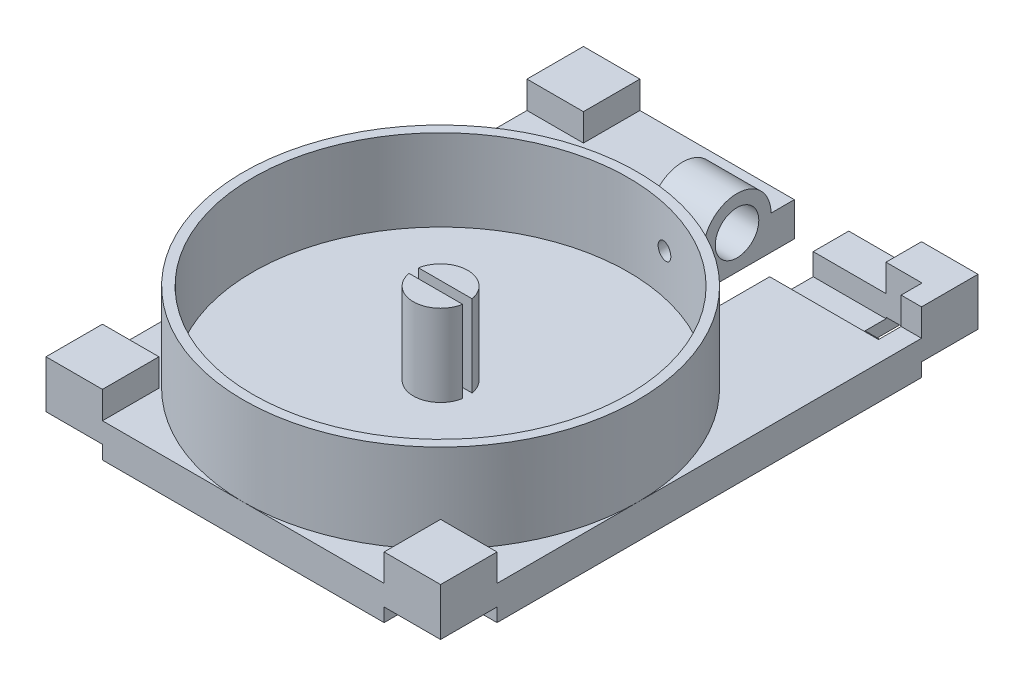
from build123d import *

# Parameters (mm, degrees)
SKETCH1_W               = 29
SKETCH1_H               = 50
BOSS_EXTRUDE1_DEPTH     = 2.5
BOSS_EXTRUDE3_DEPTH     = 6
BOSS_EXTRUDE4_DEPTH     = 6
CUT_EXTRUDE1_DEPTH      = 6
CUT_EXTRUDE2_DEPTH      = 6
CUT_EXTRUDE3_DEPTH      = 10
CUT_EXTRUDE3_DEPTH_BACK = 4
SKETCH6_R               = 1.6
SKETCH7_R               = 2.5
SKETCH7_R_2             = 1.6
BOSS_EXTRUDE6_DEPTH     = 4
SKETCH8_W               = 3.2
SKETCH8_H               = 1.6
CUT_EXTRUDE4_DEPTH      = 8
CUT_EXTRUDE5_DEPTH      = 5
SKETCH10_R              = 12.5
SKETCH10_W              = 4.15
SKETCH10_H              = 4.15
CUT_EXTRUDE7_DEPTH      = 1
SKETCH11_W              = 4.15
SKETCH11_H              = 4.15
BOSS_EXTRUDE7_DEPTH     = 2
SKETCH13_R              = 1.1
CUT_EXTRUDE8_DEPTH      = 1.1
SKETCH14_R              = 12.5
CUT_EXTRUDE9_DEPTH      = 1
SKETCH15_R              = 13.8
BOSS_EXTRUDE8_DEPTH     = 0.5
SKETCH16_R              = 14.5
SKETCH16_R_2            = 13.8
BOSS_EXTRUDE9_DEPTH     = 0.5


with BuildPart() as part:
    # Sketch1 → Boss-Extrude1 (new body)
    with BuildSketch(Plane(origin=(0, 0, 0), x_dir=(1, 0, 0), z_dir=(0, 1, 0))):
        with Locations((-98.70287726, -30.536357795)):
            Rectangle(SKETCH1_W, SKETCH1_H)
    extrude(amount=BOSS_EXTRUDE1_DEPTH)

    # Sketch2 → Boss-Extrude3 (add)
    with BuildSketch(Plane(origin=(0, 2.5, 0), x_dir=(1, 0, 0), z_dir=(0, 1, 0))):
        with BuildLine():
            ThreePointArc((-84.20287726, -41.036357795), (-108.955925587, -30.783309468), (-98.70287726, -55.536357795))
            ThreePointArc((-98.70287726, -55.536357795), (-88.449828932, -51.289406123), (-84.20287726, -41.036357795))
        make_face()
        with BuildLine():
            ThreePointArc((-84.90287726, -41.036357795), (-88.944803679, -50.794431376), (-98.70287726, -54.836357795))
            ThreePointArc((-98.70287726, -54.836357795), (-108.46095084, -31.278284215), (-84.90287726, -41.036357795))
        make_face(mode=Mode.SUBTRACT)
    extrude(amount=BOSS_EXTRUDE3_DEPTH)

    # Sketch3 → Boss-Extrude4 (add)
    with BuildSketch(Plane(origin=(0, 2.5, 0), x_dir=(1, 0, 0), z_dir=(0, 1, 0))):
        with BuildLine():
            Line((-100.672014126, -40.686357795), (-96.733740393, -40.686357795))
            ThreePointArc((-96.733740393, -40.686357795), (-98.70287726, -39.036357795), (-100.672014126, -40.686357795))
        make_face()
        with BuildLine():
            Line((-96.733740393, -41.386357795), (-100.672014126, -41.386357795))
            ThreePointArc((-100.672014126, -41.386357795), (-98.70287726, -43.036357795), (-96.733740393, -41.386357795))
        make_face()
    extrude(amount=BOSS_EXTRUDE4_DEPTH)

    # Sketch4 → Cut-Extrude1 (cut)
    with BuildSketch(Plane(origin=(0, 2.5, 0), x_dir=(1, 0, 0), z_dir=(0, 1, 0))):
        Polygon((-97.70287726, -14.248512358), (-97.70287726, -20.248512358), (-97.70287726, -26.248512358), (-93.70287726, -26.248512358), (-93.70287726, -14.248512358), align=None)
    extrude(amount=-CUT_EXTRUDE1_DEPTH, mode=Mode.SUBTRACT)

    # Sketch5 → Cut-Extrude2 (cut)
    with BuildSketch(Plane(origin=(0, 0, 26.248512358), x_dir=(-1, 0, 0), z_dir=(0, 0, -1))):
        with BuildLine():
            ThreePointArc((95.70287726, 5.4), (96.127141328, 5.575735931), (96.30287726, 6))
            ThreePointArc((96.30287726, 6), (95.278613191, 6.424264069), (95.70287726, 5.4))
        make_face()
    extrude(amount=-CUT_EXTRUDE2_DEPTH, mode=Mode.SUBTRACT)

    # Sketch6 → Cut-Extrude3 (cut, two sides: drawn at the far end of the back side and taken through both)
    with BuildSketch(Plane(origin=(-97.70287726, 0, 0), x_dir=(0, 0, -1), z_dir=(1, 0, 0)).offset(-CUT_EXTRUDE3_DEPTH_BACK)):
        with Locations((-20.248512358, 2.5)):
            Circle(SKETCH6_R)
    extrude(amount=CUT_EXTRUDE3_DEPTH + CUT_EXTRUDE3_DEPTH_BACK, mode=Mode.SUBTRACT)

    # Sketch7 → Boss-Extrude6 (add)
    with BuildSketch(Plane(origin=(-97.70287726, 0, 0), x_dir=(0, 0, -1), z_dir=(1, 0, 0))):
        with Locations((-20.248512358, 2.5)):
            Circle(SKETCH7_R)
        with Locations((-20.248512358, 2.5)):
            Circle(SKETCH7_R_2, mode=Mode.SUBTRACT)
    extrude(amount=-BOSS_EXTRUDE6_DEPTH)

    # Sketch8 → Cut-Extrude4 (cut)
    with BuildSketch(Plane.ZY.offset(93.70287726)):
        with Locations((20.248512358, 1.7)):
            Rectangle(SKETCH8_W, SKETCH8_H)
    extrude(amount=-CUT_EXTRUDE4_DEPTH, mode=Mode.SUBTRACT)

    # Sketch9 → Cut-Extrude5 (cut)
    with BuildSketch(Plane(origin=(0, 2.5, 0), x_dir=(1, 0, 0), z_dir=(0, 1, 0))):
        Polygon((-113.20287726, -5.536357795), (-113.20287726, -16.036357795), (-97.70287726, -16.036357795), (-97.70287726, -14.248512358), (-93.70287726, -14.248512358), (-93.70287726, -16.036357795), (-84.20287726, -16.036357795), (-84.20287726, -5.536357795), align=None)
    extrude(amount=-CUT_EXTRUDE5_DEPTH, mode=Mode.SUBTRACT)

    # Sketch10 → Cut-Extrude7 (cut)
    with BuildSketch(Plane.XZ):
        with Locations((-98.70287726, 41.036357795)):
            Circle(SKETCH10_R)
        with Locations((-86.27787726, 18.111357795)):
            Rectangle(SKETCH10_W, SKETCH10_H)
        with Locations((-86.27787726, 53.461357795)):
            Rectangle(SKETCH10_W, SKETCH10_H)
        with Locations((-111.12787726, 18.111357795)):
            Rectangle(SKETCH10_W, SKETCH10_H)
        with Locations((-111.12787726, 53.461357795)):
            Rectangle(SKETCH10_W, SKETCH10_H)
    extrude(amount=-CUT_EXTRUDE7_DEPTH, mode=Mode.SUBTRACT)

    # Sketch11 → Boss-Extrude7 (add)
    with BuildSketch(Plane(origin=(0, 2.5, 0), x_dir=(1, 0, 0), z_dir=(0, 1, 0))):
        Polygon((-88.35287726, -16.036357795), (-88.35287726, -18.648512358), (-85.70287726, -18.648512358), (-85.70287726, -20.186357795), (-84.20287726, -20.186357795), (-84.20287726, -16.036357795), align=None)
        with Locations((-111.12787726, -53.461357795)):
            Rectangle(SKETCH11_W, SKETCH11_H)
        with Locations((-86.27787726, -53.461357795)):
            Rectangle(SKETCH11_W, SKETCH11_H)
        with Locations((-111.12787726, -18.111357795)):
            Rectangle(SKETCH11_W, SKETCH11_H)
    extrude(amount=BOSS_EXTRUDE7_DEPTH)

    # Sketch13 → Cut-Extrude8 (cut)
    with BuildSketch(Plane.XZ.offset(-1)):
        with Locations((-111.12787726, 53.461357795)):
            Circle(SKETCH13_R)
        with Locations((-86.27787726, 53.461357795)):
            Circle(SKETCH13_R)
        with Locations((-111.12787726, 18.111357795)):
            Circle(SKETCH13_R)
        with Locations((-86.27787726, 18.111357795)):
            Circle(SKETCH13_R)
    extrude(amount=-CUT_EXTRUDE8_DEPTH, mode=Mode.SUBTRACT)

    # Sketch14 → Cut-Extrude9 (cut)
    with BuildSketch(Plane.XZ.offset(-1)):
        with Locations((-98.70287726, 41.036357795)):
            Circle(SKETCH14_R)
    extrude(amount=-CUT_EXTRUDE9_DEPTH, mode=Mode.SUBTRACT)

    # Sketch15 → Boss-Extrude8 (add)
    with BuildSketch(Plane(origin=(0, 2.5, 0), x_dir=(1, 0, 0), z_dir=(0, 1, 0))):
        with Locations((-98.70287726, -41.036357795)):
            Circle(SKETCH15_R)
    extrude(amount=BOSS_EXTRUDE8_DEPTH)

    # Sketch16 → Boss-Extrude9 (add)
    # profile 1 of 3: a face of its own
    with BuildSketch(Plane(origin=(0, 8.5, 0), x_dir=(1, 0, 0), z_dir=(0, 1, 0))):
        with Locations((-98.70287726, -41.036357795)):
            Circle(SKETCH16_R)
        with Locations((-98.70287726, -41.036357795)):
            Circle(SKETCH16_R_2, mode=Mode.SUBTRACT)
    # profile 2 of 3: a face of its own
    with BuildSketch(Plane(origin=(0, 8.5, 0), x_dir=(1, 0, 0), z_dir=(0, 1, 0))):
        with BuildLine():
            ThreePointArc((-96.733740393, -40.686357795), (-98.70287726, -39.036357795), (-100.672014126, -40.686357795))
            Line((-100.672014126, -40.686357795), (-96.733740393, -40.686357795))
        make_face()
    # profile 3 of 3: a face of its own
    with BuildSketch(Plane(origin=(0, 8.5, 0), x_dir=(1, 0, 0), z_dir=(0, 1, 0))):
        with BuildLine():
            ThreePointArc((-100.672014126, -41.386357795), (-98.70287726, -43.036357795), (-96.733740393, -41.386357795))
            Line((-96.733740393, -41.386357795), (-100.672014126, -41.386357795))
        make_face()
    extrude(amount=BOSS_EXTRUDE9_DEPTH)


solid = part.part
